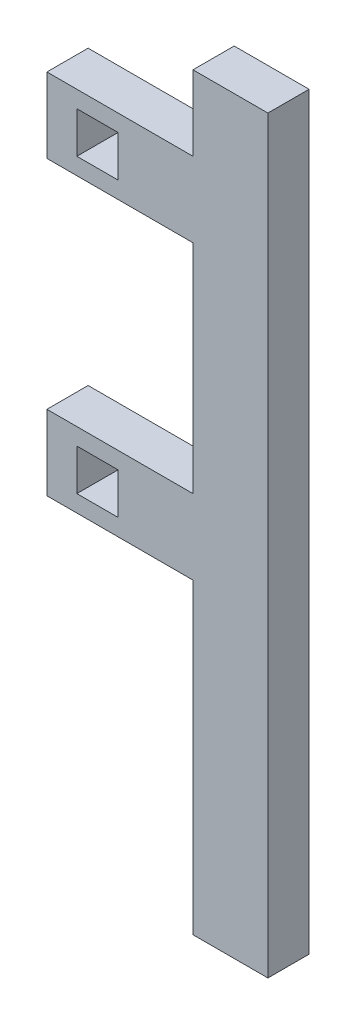
from build123d import *

# Parameters (mm, degrees)
SKETCH_1_W      = 5.5
SKETCH_1_H      = 5.5
EXTRUDE_1_DEPTH = 5.5


with BuildPart() as part:
    # ｽｹｯﾁ1 → ﾎﾞｽ - 押し出し1 (new body)
    with BuildSketch(Plane.XY):
        Polygon((-6.75, 5), (-6.75, -5), (12.75, -5), (12.75, -46), (22.75, -46), (22.75, 54), (12.75, 54), (12.75, 44), (-6.75, 44), (-6.75, 34), (12.75, 34), (12.75, 5), align=None)
        Rectangle(SKETCH_1_W, SKETCH_1_H, mode=Mode.SUBTRACT)
        with Locations((0, 39)):
            Rectangle(SKETCH_1_W, SKETCH_1_H, mode=Mode.SUBTRACT)
    extrude(amount=EXTRUDE_1_DEPTH)


solid = part.part
